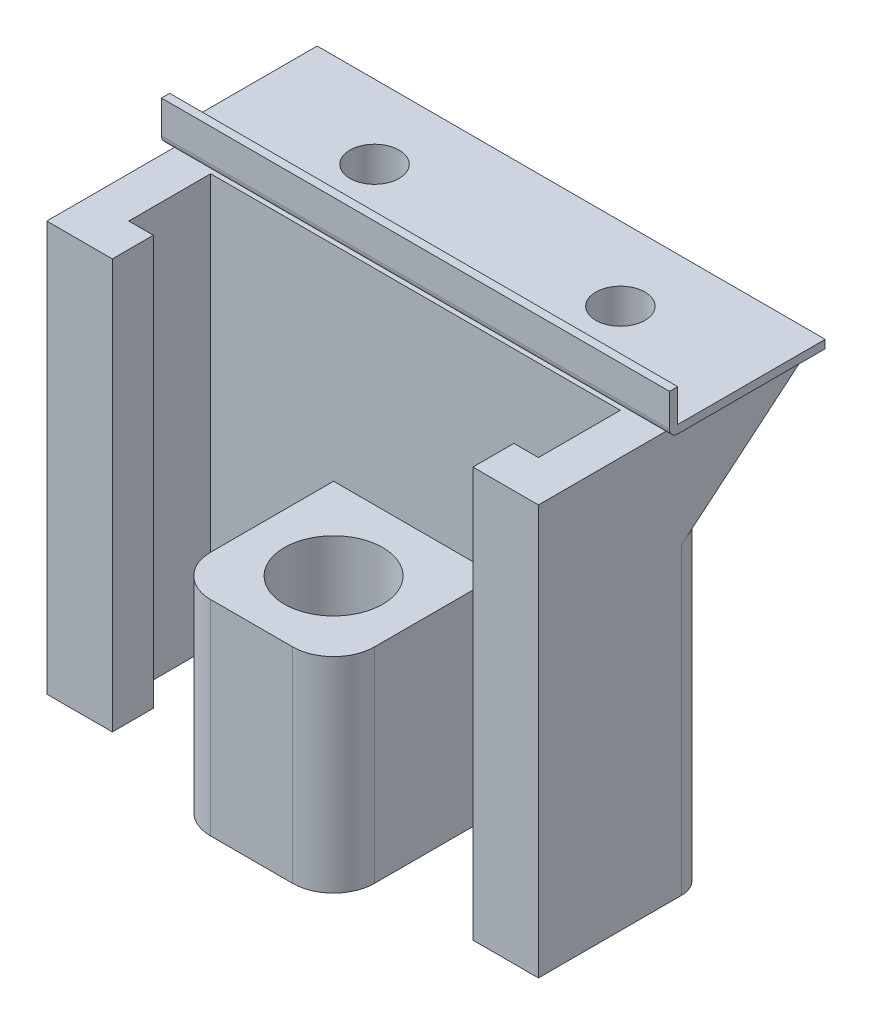
from build123d import *

# Parameters (mm, degrees)
EXTRUDE_1_DEPTH           = 50
FILLET_3_R                = 3
FILLET_4_R                = 3
EXTRUDE_4_DEPTH           = 60
EXTRUDE_5_DEPTH           = 62
CUT_EXTRUDE_7_DEPTH       = 63.635852353
CUT_EXTRUDE_7_DEPTH_BACK  = 4
SKETCH_8_R                = 3
EXTRUDE_6_DEPTH           = 25
CUT_EXTRUDE_10_DEPTH      = 67.695202226
CUT_EXTRUDE_10_DEPTH_BACK = 10


with BuildPart() as part:
    # 草图2 → 凸台-拉伸1 (new body)
    with BuildSketch(Plane(origin=(0, 0, 0), x_dir=(1, 0, 0), z_dir=(0, 1, 0))):
        with BuildLine():
            Line((25, -7.5), (22, -7.5))
            Line((22, -7.5), (22, -12.5))
            Line((22, -12.5), (30, -12.5))
            Line((30, -12.5), (30, 7.407682229))
            ThreePointArc((30, 7.407682229), (26.399187572, 8.899187572), (24.907682229, 12.5))
            Line((24.907682229, 12.5), (-25, 12.5))
            ThreePointArc((-25, 12.5), (-26.464466094, 8.964466094), (-30, 7.5))
            Line((-30, 7.5), (-30, -12.5))
            Line((-30, -12.5), (-22, -12.5))
            Line((-22, -12.5), (-22, -7.5))
            Line((-22, -7.5), (-25, -7.5))
            Line((-25, -7.5), (-25, 2.5))
            Line((-25, 2.5), (25, 2.5))
            Line((25, 2.5), (25, -7.5))
        make_face()
    extrude(amount=EXTRUDE_1_DEPTH)

    # 圆角3
    fillet_3_edges = [part.edges().sort_by_distance(p)[0] for p in [
        (-30, 25, -7.5),
        (-25, 25, -12.5),
    ]]
    fillet(fillet_3_edges, radius=FILLET_3_R)

    # 圆角4
    fillet_4_edges = [part.edges().sort_by_distance(p)[0] for p in [
        (24.907682229, 25, -12.5),
        (30, 25, -7.407682229),
    ]]
    fillet(fillet_4_edges, radius=FILLET_4_R)

    # 草图5 → 凸台-拉伸4 (add)
    with BuildSketch(Plane.ZY.offset(30)):
        Polygon((-2.5, 50), (-20.5, 50), (-2.5, 35), align=None)
    extrude(amount=-EXTRUDE_4_DEPTH)

    # 草图7 → 凸台-拉伸5 (add)
    with BuildSketch(Plane.ZY.offset(31)):
        with BuildLine():
            Line((-2.5, 51), (-2.5, 51.591557712))
            Line((-2.5, 51.591557712), (-2.5, 55))
            Line((-2.5, 55), (-3.5, 55))
            Line((-3.5, 55), (-3.5, 52))
            ThreePointArc((-3.5, 52), (-2.792893219, 51.707106781), (-2.5, 51))
        make_face()
        with BuildLine():
            ThreePointArc((-3.5, 50), (-2.792893219, 50.292893219), (-2.5, 51))
            ThreePointArc((-2.5, 51), (-2.792893219, 51.707106781), (-3.5, 52))
            Line((-3.5, 52), (-3.5, 51))
            Line((-3.5, 51), (-4.5, 51))
            ThreePointArc((-4.5, 51), (-4.207106781, 50.292893219), (-3.5, 50))
        make_face()
        with BuildLine():
            Line((-21.5, 50), (-3.5, 50))
            ThreePointArc((-3.5, 50), (-4.207106781, 50.292893219), (-4.5, 51))
            Line((-4.5, 51), (-21.5, 51))
            Line((-21.5, 51), (-21.5, 50))
        make_face()
    extrude(amount=-EXTRUDE_5_DEPTH)

    # 草图8 → 切除-拉伸7 (cut, two sides: drawn at the far end of the back side and taken through both)
    with BuildSketch(Plane(origin=(0, 50, 0), x_dir=(1, 0, 0), z_dir=(0, 1, 0)).offset(-CUT_EXTRUDE_7_DEPTH_BACK)):
        with Locations(Location((-15, 12.5, 0), (0, 0, 90))):
            Circle(SKETCH_8_R)
        with Locations(Location((15, 12.5, 0), (0, 0, 90))):
            Circle(SKETCH_8_R)
    extrude(amount=CUT_EXTRUDE_7_DEPTH + CUT_EXTRUDE_7_DEPTH_BACK, mode=Mode.SUBTRACT)

    # 草图9 → 凸台-拉伸6 (add)
    with BuildSketch(Plane(origin=(0, 0, 0), x_dir=(1, 0, 0), z_dir=(0, 1, 0))):
        with BuildLine():
            Line((-5, -17.5), (5, -17.5))
            ThreePointArc((5, -17.5), (8.535533906, -16.035533906), (10, -12.5))
            Line((10, -12.5), (10, 2.5))
            Line((10, 2.5), (-10, 2.5))
            Line((-10, 2.5), (-10, -12.5))
            ThreePointArc((-10, -12.5), (-8.535533906, -16.035533906), (-5, -17.5))
        make_face()
    extrude(amount=EXTRUDE_6_DEPTH)

    # 草图9<8> → 切除-拉伸10 (cut, two sides: drawn at the far end of the back side and taken through both)
    with BuildSketch(Plane(origin=(0, 0, 0), x_dir=(1, 0, 0), z_dir=(0, 1, 0)).offset(-CUT_EXTRUDE_10_DEPTH_BACK)):
        with BuildLine():
            ThreePointArc((0, -1.5), (-6, -7.5), (0, -13.5))
            Line((0, -13.5), (0, -7.5))
            Line((0, -7.5), (0, -1.5))
        make_face()
        with BuildLine():
            Line((0, -7.5), (0, -13.5))
            ThreePointArc((0, -13.5), (4.242640687, -11.742640687), (6, -7.5))
            ThreePointArc((6, -7.5), (4.242640687, -3.257359313), (0, -1.5))
            Line((0, -1.5), (0, -7.5))
        make_face()
    extrude(amount=CUT_EXTRUDE_10_DEPTH + CUT_EXTRUDE_10_DEPTH_BACK, mode=Mode.SUBTRACT)


solid = part.part
